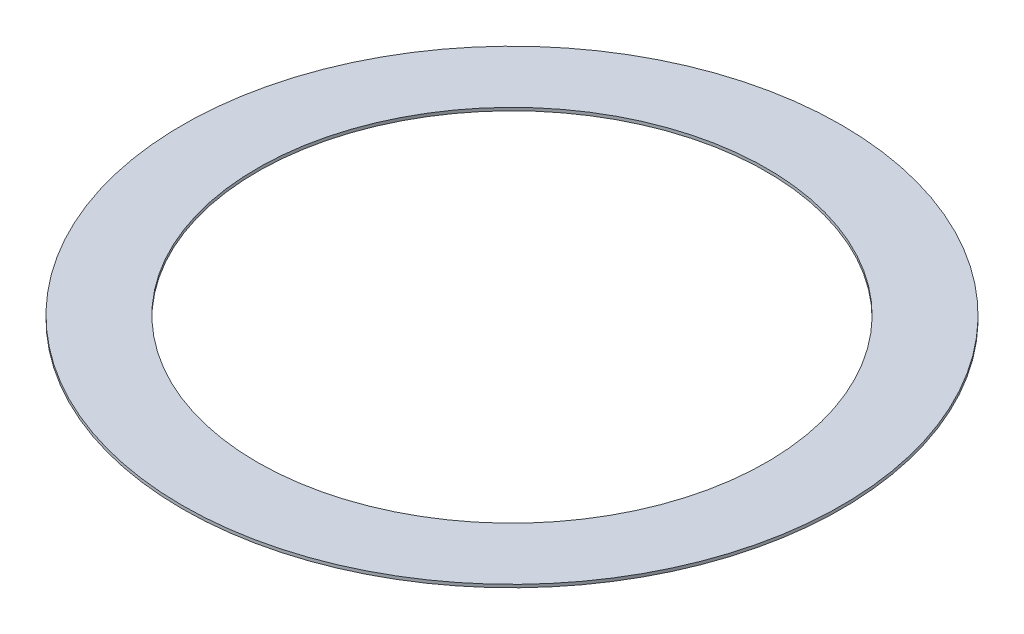
from build123d import *

# Parameters (mm, degrees)
SKETCH_1_R      = 11
SKETCH_1_R_2    = 8.5
EXTRUDE_1_DEPTH = 0.1


with BuildPart() as part:
    # 草图1 → 凸台-拉伸1 (new body)
    with BuildSketch(Plane(origin=(0, 0, 0), x_dir=(1, 0, 0), z_dir=(0, 1, 0))):
        with Locations(Location((0, 0, 0), (0, 0, 270))):
            Circle(SKETCH_1_R)
        with Locations(Location((0, 0, 0), (0, 0, 270))):
            Circle(SKETCH_1_R_2, mode=Mode.SUBTRACT)
    extrude(amount=EXTRUDE_1_DEPTH)


solid = part.part
